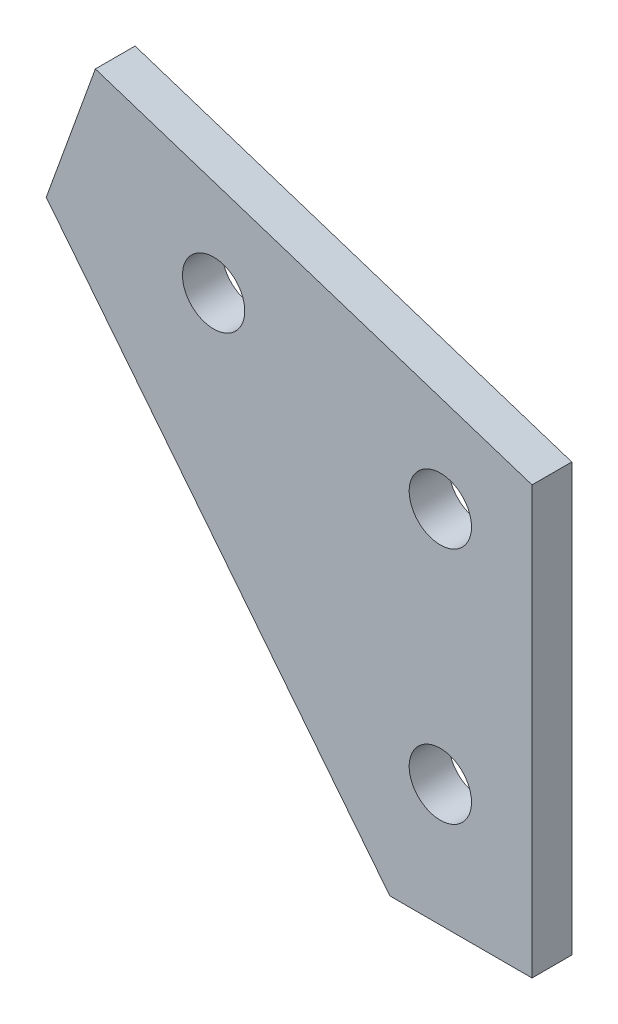
from build123d import *

# Parameters (mm, degrees)
BOSS_EXTRUDE1_DEPTH    = 3.175
F_10_CLEARANCE_HOLE1_D = 4.9784


with BuildPart() as part:
    # Sketch4 → Boss-Extrude1 (new body)
    with BuildSketch(Plane.XY):
        Polygon((-42.188928966, 293.919436917), (-7.296735047, 282.582275868), (-7.296735047, 248.458198081), (-18.653675695, 248.458198081), (-46.113444794, 283.07832781), align=None)
    extrude(amount=BOSS_EXTRUDE1_DEPTH)

    # #10 Clearance Hole1 (through all)
    with Locations(Plane.XY.offset(3.175)):
        with Locations((-32.740251946, 283.138719963), (-14.622625311, 277.25194622), (-14.622625311, 258.20194622)):
            Hole(F_10_CLEARANCE_HOLE1_D / 2)


solid = part.part
